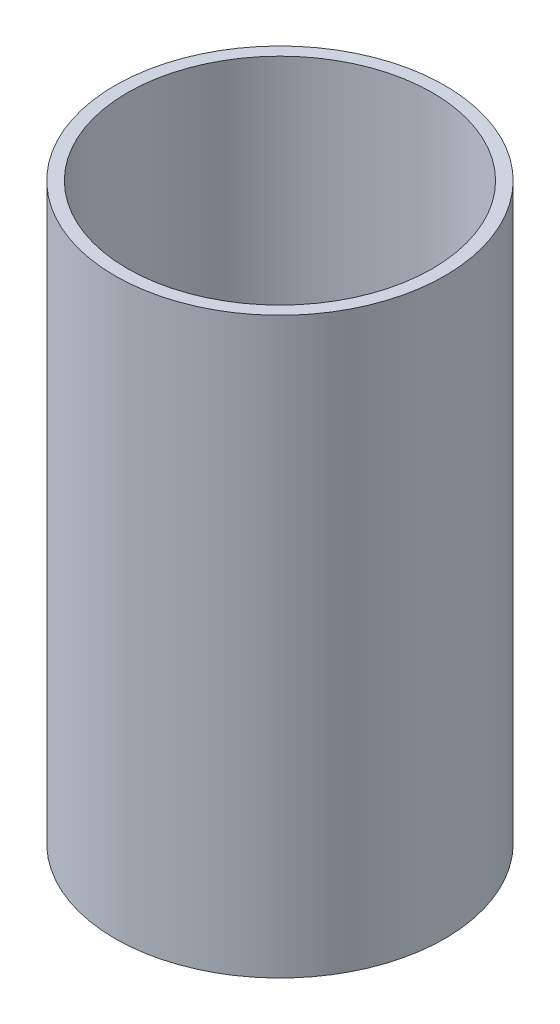
from build123d import *

# Parameters (mm, degrees)
SKETCH1_R           = 33.1
BOSS_EXTRUDE1_DEPTH = 115.2
SHELL1_T            = 2.5
CUT_EXTRUDE1_START  = -30
SKETCH2_R           = 30.6
CUT_EXTRUDE1_DEPTH  = 30


with BuildPart() as part:
    # Sketch1 → Boss-Extrude1 (new body)
    with BuildSketch(Plane(origin=(0, 0, 0), x_dir=(1, 0, 0), z_dir=(0, 1, 0))):
        with Locations(Location((0, 0, 0), (0, 0, 270))):
            Circle(SKETCH1_R)
    extrude(amount=BOSS_EXTRUDE1_DEPTH)

    # Shell1 (no face opened: a closed hollow body)
    add(offset(amount=-SHELL1_T, mode=Mode.PRIVATE), mode=Mode.SUBTRACT)

    # Sketch2 → Cut-Extrude1 (cut)
    with BuildSketch(Plane(origin=(0, 115.2, 0), x_dir=(1, 0, 0), z_dir=(0, 1, 0)).offset(CUT_EXTRUDE1_START)):
        with Locations(Location((0, 0, 0), (0, 0, 270))):
            Circle(SKETCH2_R)
    extrude(amount=CUT_EXTRUDE1_DEPTH, mode=Mode.SUBTRACT)


solid = part.part
